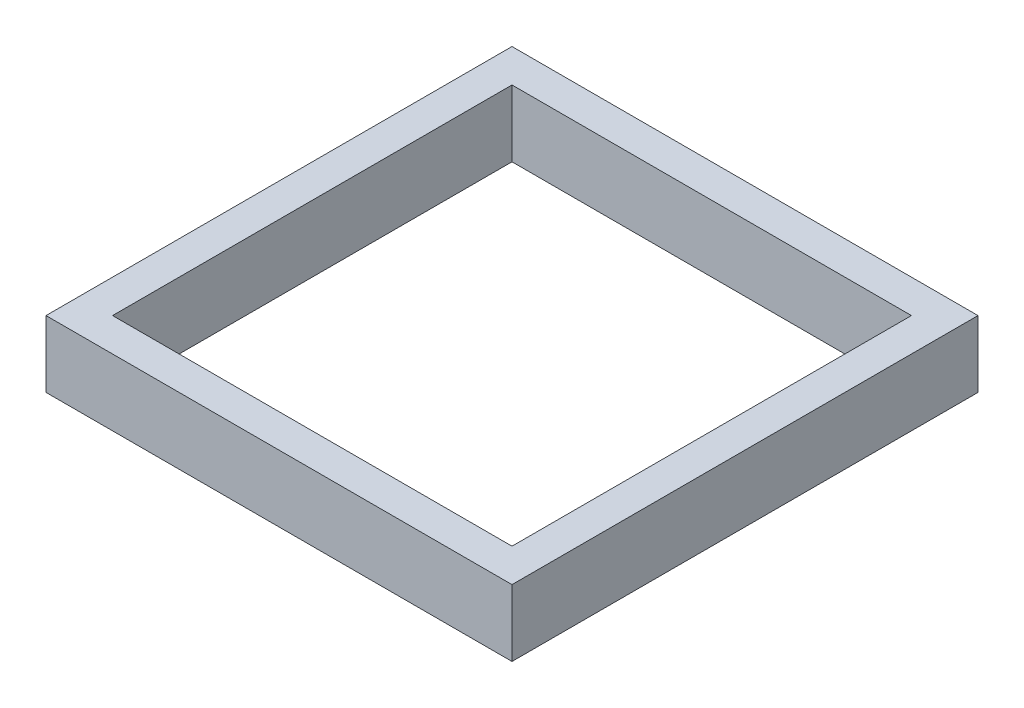
from build123d import *

# Parameters (mm, degrees)
SKETCH1_W           = 700
SKETCH1_H           = 700
SKETCH1_W_2         = 600
SKETCH1_H_2         = 600
BOSS_EXTRUDE1_DEPTH = 100


with BuildPart() as part:
    # Sketch1 → Boss-Extrude1 (new body)
    with BuildSketch(Plane(origin=(0, 0, 0), x_dir=(1, 0, 0), z_dir=(0, 1, 0))):
        with Locations((-293.194394822, -193.360150333)):
            Rectangle(SKETCH1_W, SKETCH1_H)
        with Locations((-293.194394822, -193.360150333)):
            Rectangle(SKETCH1_W_2, SKETCH1_H_2, mode=Mode.SUBTRACT)
    extrude(amount=BOSS_EXTRUDE1_DEPTH)


solid = part.part
